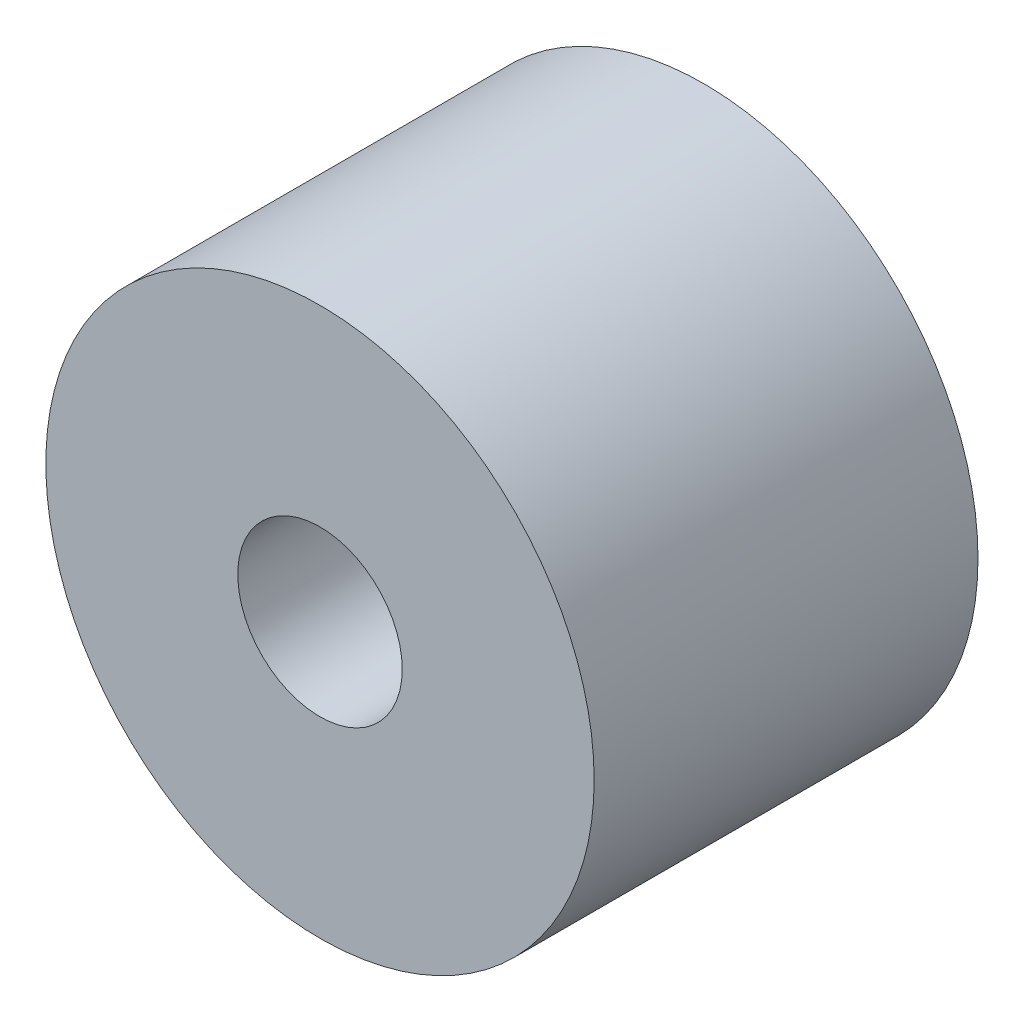
from build123d import *

# Parameters (mm, degrees)
SKETCH_1_R        = 5
SKETCH_1_R_2      = 1.5
EXTRUDE_240_DEPTH = 3.5


with BuildPart() as part:
    # Эскиз1 → Extrude 240 (new, symmetric)
    with BuildSketch(Plane.XY):
        Circle(SKETCH_1_R)
        Circle(SKETCH_1_R_2, mode=Mode.SUBTRACT)
    extrude(amount=EXTRUDE_240_DEPTH, both=True)


solid = part.part
